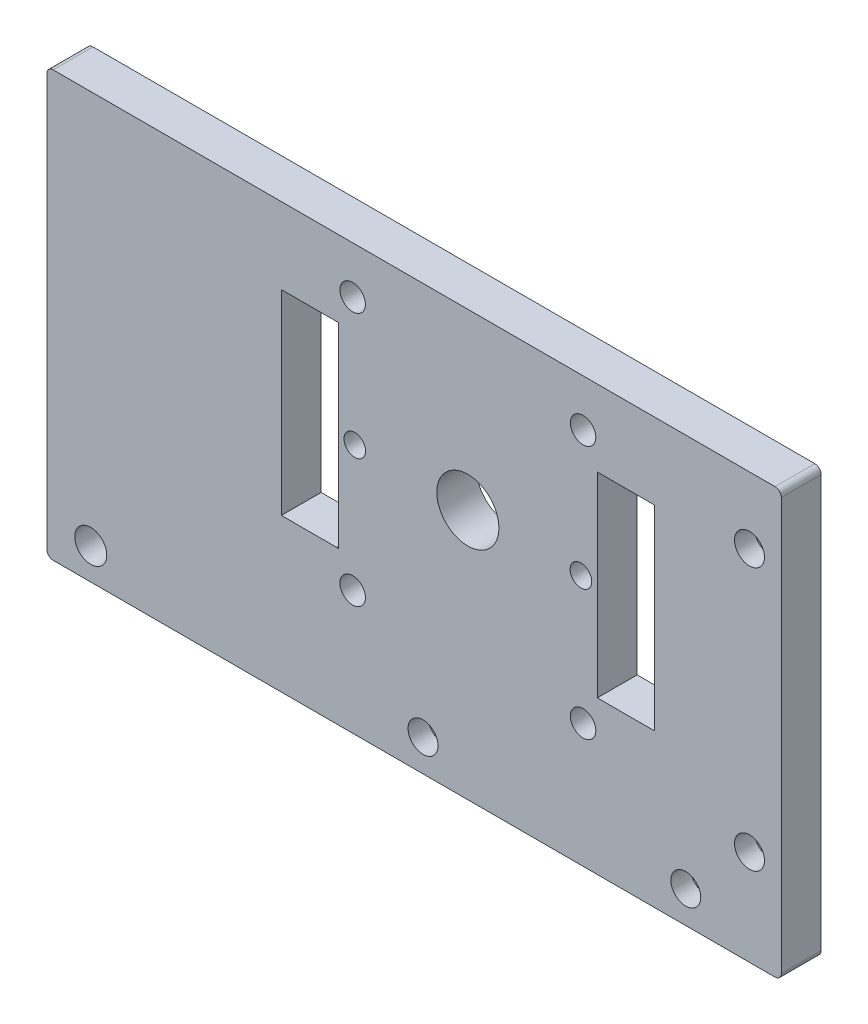
from build123d import *

# Parameters (mm, degrees)
SKETCH5_W               = 91.75
SKETCH5_H               = 67.75
SKETCH5_R               = 2.3876
SKETCH5_R_2             = 3.683
SKETCH5_R_3             = 4.953
SKETCH5_W_2             = 8.85
SKETCH5_H_2             = 31.2
SKETCH5_R_4             = 1.5875
BOSS_EXTRUDE1_DEPTH     = 6.35
F_8_32_TAPPED_HOLE1_D   = 3.4544
CUT_EXTRUDE2_START      = 3.175
SKETCH5_3_R             = 2.3876
SKETCH5_3_R_2           = 1.5875
CUT_EXTRUDE2_DEPTH      = 3.175
SKETCH8_W               = 25.4
SKETCH8_H               = 67.75
SKETCH8_R               = 1
BOSS_EXTRUDE2_DEPTH     = 6.35
F_1_4_20_TAPPED_HOLE2_D = 5.1054
CUT_EXTRUDE3_DEPTH      = 140.2958778
CUT_EXTRUDE3_DEPTH_BACK = 140.2958778
SKETCH11_R              = 2.032
CUT_EXTRUDE4_DEPTH      = 140.2958778
CUT_EXTRUDE4_DEPTH_BACK = 140.2958778
SKETCH12_W              = 0.25
SKETCH12_H              = 31.2
SKETCH12_H_2            = 31.222616973
FILLET2_R               = 1


with BuildPart() as part:
    # Sketch5 → Boss-Extrude1 (new body)
    # profile 1 of 6: a face of its own
    with BuildSketch(Plane.XY):
        with Locations((-48.669, 36.669)):
            Rectangle(SKETCH5_W, SKETCH5_H)
        with Locations((-7.874, 18.034)):
            Circle(SKETCH5_R, mode=Mode.SUBTRACT)
        with Locations((-7.874, 59.944)):
            Circle(SKETCH5_R, mode=Mode.SUBTRACT)
        with Locations((-18.034, 7.874)):
            Circle(SKETCH5_R, mode=Mode.SUBTRACT)
        with Locations((-59.944, 7.874)):
            Circle(SKETCH5_R, mode=Mode.SUBTRACT)
        with Locations((-19.9136, 19.9136)):
            Circle(SKETCH5_R_2, mode=Mode.SUBTRACT)
        with Locations((-52.794, 42.794)):
            Circle(SKETCH5_R_3, mode=Mode.SUBTRACT)
        with Locations((-78.119, 42.794)):
            Rectangle(SKETCH5_W_2, SKETCH5_H_2, mode=Mode.SUBTRACT)
        with Locations((-27.469, 42.794)):
            Rectangle(SKETCH5_W_2, SKETCH5_H_2, mode=Mode.SUBTRACT)
    # profile 2 of 6: a face of its own
    with BuildSketch(Plane.XY):
        with Locations((-7.874, 59.944)):
            Circle(SKETCH5_R)
        with Locations((-7.874, 59.944)):
            Circle(SKETCH5_R_4, mode=Mode.SUBTRACT)
    # profile 3 of 6: a face of its own
    with BuildSketch(Plane.XY):
        with Locations((-19.9136, 19.9136)):
            Circle(SKETCH5_R_2)
    # profile 4 of 6: a face of its own
    with BuildSketch(Plane.XY):
        with Locations((-7.874, 18.034)):
            Circle(SKETCH5_R)
        with Locations((-7.874, 18.034)):
            Circle(SKETCH5_R_4, mode=Mode.SUBTRACT)
    # profile 5 of 6: a face of its own
    with BuildSketch(Plane.XY):
        with Locations((-18.034, 7.874)):
            Circle(SKETCH5_R)
        with Locations((-18.034, 7.874)):
            Circle(SKETCH5_R_4, mode=Mode.SUBTRACT)
    # profile 6 of 6: a face of its own
    with BuildSketch(Plane.XY):
        with Locations((-59.944, 7.874)):
            Circle(SKETCH5_R)
        with Locations((-59.944, 7.874)):
            Circle(SKETCH5_R_4, mode=Mode.SUBTRACT)
    extrude(amount=BOSS_EXTRUDE1_DEPTH)

    # #8-32 Tapped Hole1 (through all)
    with Locations(Plane(origin=(-70.828, 42.794, 6.35), x_dir=(1, 0, 0), z_dir=(0, 0, 1))):
        with Locations((0, 0), (36.068, 0)):
            Hole(F_8_32_TAPPED_HOLE1_D / 2)

    # Sketch5<3> → Cut-Extrude2 (cut)
    # profile 1 of 4: a face of its own
    with BuildSketch(Plane.XY.offset(CUT_EXTRUDE2_START)):
        with Locations((-18.034, 7.874)):
            Circle(SKETCH5_3_R)
        with Locations((-18.034, 7.874)):
            Circle(SKETCH5_3_R_2, mode=Mode.SUBTRACT)
    # profile 2 of 4: a face of its own
    with BuildSketch(Plane.XY.offset(CUT_EXTRUDE2_START)):
        with Locations((-7.874, 18.034)):
            Circle(SKETCH5_3_R)
        with Locations((-7.874, 18.034)):
            Circle(SKETCH5_3_R_2, mode=Mode.SUBTRACT)
    # profile 3 of 4: a face of its own
    with BuildSketch(Plane.XY.offset(CUT_EXTRUDE2_START)):
        with Locations((-59.944, 7.874)):
            Circle(SKETCH5_3_R)
        with Locations((-59.944, 7.874)):
            Circle(SKETCH5_3_R_2, mode=Mode.SUBTRACT)
    # profile 4 of 4: a face of its own
    with BuildSketch(Plane.XY.offset(CUT_EXTRUDE2_START)):
        with Locations((-7.874, 59.944)):
            Circle(SKETCH5_3_R)
        with Locations((-7.874, 59.944)):
            Circle(SKETCH5_3_R_2, mode=Mode.SUBTRACT)
    extrude(amount=CUT_EXTRUDE2_DEPTH, mode=Mode.SUBTRACT)

    # Sketch8 → Boss-Extrude2 (add)
    with BuildSketch(Plane.XY):
        with Locations((-107.244, 36.669)):
            Rectangle(SKETCH8_W, SKETCH8_H)
        with Locations((-112.944, 7.794)):
            Circle(SKETCH8_R, mode=Mode.SUBTRACT)
    extrude(amount=BOSS_EXTRUDE2_DEPTH)

    # 1/4-20 Tapped Hole2 (through all)
    with Locations(Plane(origin=(-112.944, 7.794, 6.35), x_dir=(1, 0, 0), z_dir=(0, 0, 1))):
        with Locations((0, 0)):
            Hole(F_1_4_20_TAPPED_HOLE2_D / 2)

    # Sketch11 → Cut-Extrude3 (cut, two sides: drawn at the far end of the back side and taken through both)
    with BuildSketch(Plane.XY.offset(6.35).offset(-CUT_EXTRUDE3_DEPTH_BACK)):
        with Locations((-71.169, 63.044)):
            Circle(SKETCH11_R)
        with Locations((-34.419, 63.044)):
            Circle(SKETCH11_R)
        with Locations((-34.419, 22.544)):
            Circle(SKETCH11_R)
        with Locations((-71.169, 22.544)):
            Circle(SKETCH11_R)
    extrude(amount=CUT_EXTRUDE3_DEPTH + CUT_EXTRUDE3_DEPTH_BACK, mode=Mode.SUBTRACT)

    # Sketch12 → Cut-Extrude4 (cut, two sides: drawn at the far end of the back side and taken through both)
    with BuildSketch(Plane.XY.offset(6.35).offset(-CUT_EXTRUDE4_DEPTH_BACK)):
        with Locations((-32.019, 42.794)):
            Rectangle(SKETCH12_W, SKETCH12_H)
        with Locations((-73.569, 42.782691514)):
            Rectangle(SKETCH12_W, SKETCH12_H_2)
    extrude(amount=CUT_EXTRUDE4_DEPTH + CUT_EXTRUDE4_DEPTH_BACK, mode=Mode.SUBTRACT)

    # Fillet2
    fillet2_edges = [part.edges().sort_by_distance(p)[0] for p in [
        (-119.944, 70.544, 3.175),
        (-2.794, 2.794, 3.175),
        (-2.794, 70.544, 3.175),
        (-119.944, 2.794, 3.175),
    ]]
    fillet(fillet2_edges, radius=FILLET2_R)


solid = part.part
